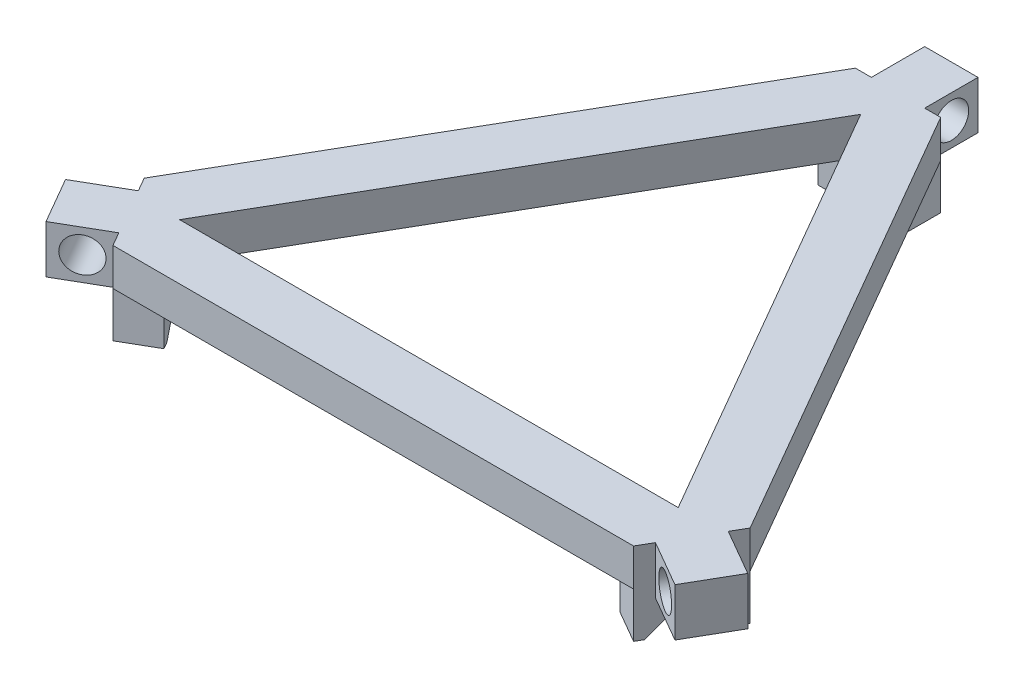
from build123d import *

# Parameters (mm, degrees)
BOSS_EXTRUDE1_DEPTH          = 1.778
BOSS_EXTRUDE2_DEPTH          = 2.159
CUT_EXTRUDE1_DEPTH           = 28.428162383
BOSS_EXTRUDE4_DEPTH          = 2.286
F_97_0_0059_DIAMETER_HOLE1_D = 1.651
CIRPATTERN2_COUNT            = 3
CIRPATTERN3_COUNT            = 3


with BuildPart() as part:
    # Sketch1 → Boss-Extrude1 (new body)
    with BuildSketch(Plane(origin=(0, 0, 0), x_dir=(1, 0, 0), z_dir=(0, 1, 0))):
        Polygon((-2.032, 15.494), (-14.434197606, -5.98723638), (-13.418197606, -7.747), (-12.402197606, -9.50676362), (12.402197606, -9.50676362), (13.418197606, -7.747), (14.434197606, -5.98723638), (2.032, 15.494), (0, 15.494), align=None)
        Polygon((0, 13.716), (-11.878404438, -6.858), (11.878404438, -6.858), align=None, mode=Mode.SUBTRACT)
    extrude(amount=BOSS_EXTRUDE1_DEPTH)

    # Sketch3 → Boss-Extrude2 (add)
    with BuildSketch(Plane(origin=(0, 0, 0), x_dir=(-1, 0, 0), z_dir=(0, -1, 0))):
        Polygon((0, 13.716), (2.032, 13.716), (2.032, 15.494), (-2.032, 15.494), (-2.032, 13.716), align=None)
    boss_extrude2 = extrude(amount=BOSS_EXTRUDE2_DEPTH)

    # Sketch4 → Cut-Extrude1 (cut, through all)
    with BuildSketch(Plane.XY.offset(-13.716)):
        Polygon((0, -0.508), (-2.694076836, -3.202076836), (2.694076836, -3.202076836), align=None)
    cut_extrude1 = extrude(amount=-CUT_EXTRUDE1_DEPTH, mode=Mode.SUBTRACT)

    # Sketch6 → Boss-Extrude4 (add)
    with BuildSketch(Plane(origin=(0, 1.778, 0), x_dir=(1, 0, 0), z_dir=(0, 1, 0))):
        Polygon((0, 15.494), (1.27, 15.494), (1.27, 18.034), (-1.27, 18.034), (-1.27, 15.494), align=None)
    boss_extrude4 = extrude(amount=-BOSS_EXTRUDE4_DEPTH)

    # #97 (0.0059) Diameter Hole1 (through all)
    with Locations(Plane(origin=(1.27, 0, 0), x_dir=(0, 0, -1), z_dir=(1, 0, 0))):
        with Locations((16.764, 0.635)):
            f_97_0_0059_diameter_hole1 = Hole(F_97_0_0059_DIAMETER_HOLE1_D / 2)

    # CirPattern2: Boss-Extrude2, Cut-Extrude1 ×3 about axis
    cirpattern2_axis = Axis((0, 0, 0), (0, 1, 0))
    add([boss_extrude2.rotate(cirpattern2_axis, i * 360 / CIRPATTERN2_COUNT) for i in range(1, CIRPATTERN2_COUNT)])
    add([cut_extrude1.rotate(cirpattern2_axis, i * 360 / CIRPATTERN2_COUNT) for i in range(1, CIRPATTERN2_COUNT)], mode=Mode.SUBTRACT)

    # CirPattern3: Boss-Extrude4, #97 (0.0059) Diameter Hole1 ×3 about axis
    cirpattern3_axis = Axis((0, 0, 0), (0, 1, 0))
    add([boss_extrude4.rotate(cirpattern3_axis, i * 360 / CIRPATTERN3_COUNT) for i in range(1, CIRPATTERN3_COUNT)])
    add([f_97_0_0059_diameter_hole1.rotate(cirpattern3_axis, i * 360 / CIRPATTERN3_COUNT) for i in range(1, CIRPATTERN3_COUNT)], mode=Mode.SUBTRACT)


solid = part.part
